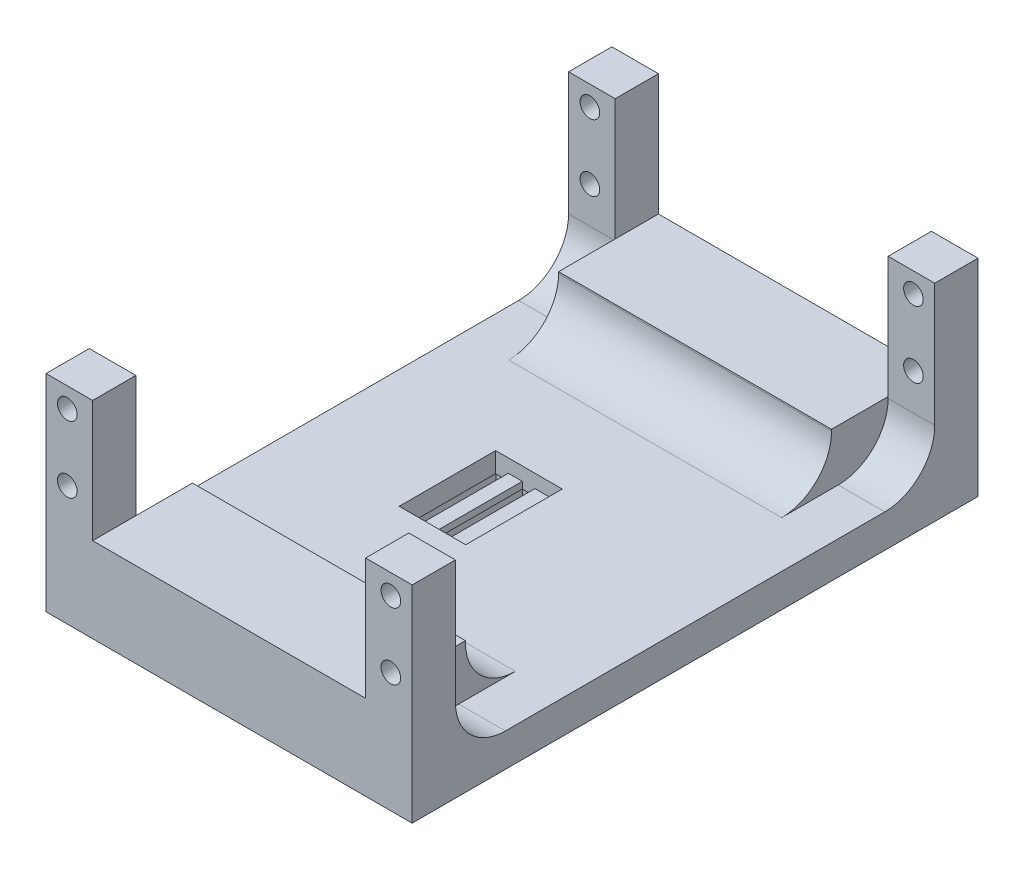
from build123d import *

# Parameters (mm, degrees)
SKETCH_1_W          = 55
SKETCH_1_H          = 85
EXTRUDE_1_DEPTH     = 5
SKETCH_2_W          = 7
SKETCH_2_H          = 6.5
EXTRUDE_2_DEPTH     = 26
SKETCH_3_R          = 1.475
CUT_EXTRUDE_1_DEPTH = 103.30377559
SKETCH_4_W          = 41
SKETCH_4_H          = 15
EXTRUDE_3_DEPTH     = 7.75
SKETCH_5_W          = 24.5
SKETCH_5_H          = 49.5
EXTRUDE_4_DEPTH     = 10
SKETCH_7_R          = 2.525
CUT_EXTRUDE_2_DEPTH = 2.25
SKETCH_8_W          = 2.7
SKETCH_8_H          = 15.4
CUT_EXTRUDE_3_DEPTH = 12
SKETCH_9_W          = 1.9
SKETCH_9_H          = 14.5
CUT_EXTRUDE_4_DEPTH = 1
SKETCH_10_W         = 10
SKETCH_10_H         = 14.5
CUT_EXTRUDE_5_DEPTH = 70.787624261
FILLET_1_R          = 3
FILLET_2_R          = 7.5


with BuildPart() as part:
    # Эскиз1 → Бобышка-Вытянуть1 (new body)
    with BuildSketch(Plane(origin=(0, 0, 0), x_dir=(1, 0, 0), z_dir=(0, 1, 0))):
        with Locations((-20.25, 0)):
            Rectangle(SKETCH_1_W, SKETCH_1_H)
    extrude(amount=EXTRUDE_1_DEPTH)

    # Эскиз2 → Бобышка-Вытянуть2 (add)
    with BuildSketch(Plane(origin=(0, 5, 0), x_dir=(1, 0, 0), z_dir=(0, 1, 0))):
        with Locations((-44.25, 39.25)):
            Rectangle(SKETCH_2_W, SKETCH_2_H)
        with Locations((3.75, 39.25)):
            Rectangle(SKETCH_2_W, SKETCH_2_H)
        with Locations((3.75, -39.25)):
            Rectangle(SKETCH_2_W, SKETCH_2_H)
        with Locations((-44.25, -39.25)):
            Rectangle(SKETCH_2_W, SKETCH_2_H)
    extrude(amount=EXTRUDE_2_DEPTH)

    # Эскиз3 → Вырез-Вытянуть1 (cut, through all)
    with BuildSketch(Plane.XY.offset(42.5)):
        with Locations((-44.55, 28)):
            Circle(SKETCH_3_R)
        with Locations((-44.55, 18)):
            Circle(SKETCH_3_R)
        with Locations((4.05, 18)):
            Circle(SKETCH_3_R)
        with Locations((4.05, 28)):
            Circle(SKETCH_3_R)
    extrude(amount=-CUT_EXTRUDE_1_DEPTH, mode=Mode.SUBTRACT)

    # Эскиз4 → Бобышка-Вытянуть3 (add)
    with BuildSketch(Plane(origin=(0, 5, 0), x_dir=(1, 0, 0), z_dir=(0, 1, 0))):
        with Locations((-20.25, 35)):
            Rectangle(SKETCH_4_W, SKETCH_4_H)
        with Locations((-20.25, -35)):
            Rectangle(SKETCH_4_W, SKETCH_4_H)
    extrude(amount=EXTRUDE_3_DEPTH)

    # Эскиз5 → Бобышка-Вытянуть4 (add)
    with BuildSketch(Plane.XZ):
        with Locations((-20.25, 0)):
            Rectangle(SKETCH_5_W, SKETCH_5_H)
    extrude(amount=EXTRUDE_4_DEPTH)

    # Эскиз7 → Вырез-Вытянуть2 (cut)
    with BuildSketch(Plane.XZ.offset(10)):
        with Locations(Location((-13, 20, 0), (0, 0, 270))):
            Circle(SKETCH_7_R)
        with Locations(Location((-13, -20, 0), (0, 0, 270))):
            Circle(SKETCH_7_R)
    extrude(amount=-CUT_EXTRUDE_2_DEPTH, mode=Mode.SUBTRACT)

    # Эскиз8 → Вырез-Вытянуть3 (cut)
    with BuildSketch(Plane.XZ.offset(10)):
        with Locations((-29, 0)):
            Rectangle(SKETCH_8_W, SKETCH_8_H)
        with Locations((-25, 0)):
            Rectangle(SKETCH_8_W, SKETCH_8_H)
    extrude(amount=-CUT_EXTRUDE_3_DEPTH, mode=Mode.SUBTRACT)

    # Эскиз9 → Вырез-Вытянуть4 (cut)
    with BuildSketch(Plane.XZ.offset(-2)):
        with Locations((-29, 0)):
            Rectangle(SKETCH_9_W, SKETCH_9_H)
        with Locations((-25, 0)):
            Rectangle(SKETCH_9_W, SKETCH_9_H)
    extrude(amount=-CUT_EXTRUDE_4_DEPTH, mode=Mode.SUBTRACT)

    # Эскиз10 → Вырез-Вытянуть5 (cut, through all)
    with BuildSketch(Plane.XZ.offset(-3)):
        with Locations((-24.95, 0)):
            Rectangle(SKETCH_10_W, SKETCH_10_H)
    extrude(amount=-CUT_EXTRUDE_5_DEPTH, mode=Mode.SUBTRACT)

    # Скругление1
    fillet_1_edges = [part.edges().sort_by_distance(p)[0] for p in [
        (-32.5, -5, 24.75),
        (-32.5, -5, -24.75),
        (-8, -5, -24.75),
        (-8, -5, 24.75),
    ]]
    fillet(fillet_1_edges, radius=FILLET_1_R)

    # Скругление2
    fillet_2_edges = [part.edges().sort_by_distance(p)[0] for p in [
        (-20.25, 5, -27.5),
        (-20.25, 5, 27.5),
        (-44.25, 5, 36),
        (3.75, 5, 36),
        (3.75, 5, -36),
        (-44.25, 5, -36),
    ]]
    fillet(fillet_2_edges, radius=FILLET_2_R)


solid = part.part
